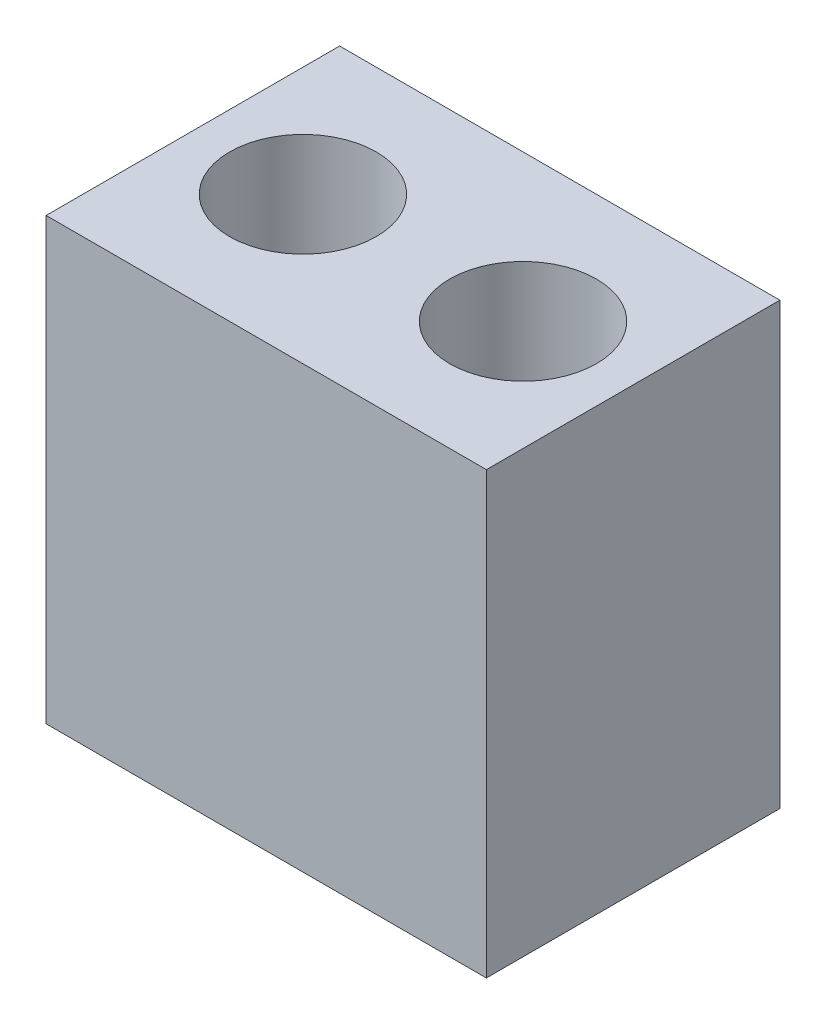
from build123d import *

# Parameters (mm, degrees)
SKETCH1_W           = 30
SKETCH1_H           = 30
BOSS_EXTRUDE1_DEPTH = 20
SKETCH2_R           = 3
SKETCH2_R_2         = 2.53
CUT_EXTRUDE1_DEPTH  = 40.05124838
SKETCH3_R           = 5
CUT_EXTRUDE2_DEPTH  = 15


with BuildPart() as part:
    # Sketch1 → Boss-Extrude1 (new body)
    with BuildSketch(Plane.XY):
        Rectangle(SKETCH1_W, SKETCH1_H)
    extrude(amount=BOSS_EXTRUDE1_DEPTH)

    # Sketch2 → Cut-Extrude1 (cut, through all)
    with BuildSketch(Plane(origin=(0, 15, 0), x_dir=(1, 0, 0), z_dir=(0, 1, 0))):
        with Locations(Location((-7.5, -10, 0), (0, 0, 270))):
            Circle(SKETCH2_R)
        with Locations(Location((7.5, -10, 0), (0, 0, 270))):
            Circle(SKETCH2_R_2)
    extrude(amount=-CUT_EXTRUDE1_DEPTH, mode=Mode.SUBTRACT)

    # Sketch3 → Cut-Extrude2 (cut)
    with BuildSketch(Plane(origin=(0, 15, 0), x_dir=(1, 0, 0), z_dir=(0, 1, 0))):
        with Locations(Location((-7.5, -10, 0), (0, 0, 270))):
            Circle(SKETCH3_R)
        with Locations(Location((7.5, -10, 0), (0, 0, 270))):
            Circle(SKETCH3_R)
    extrude(amount=-CUT_EXTRUDE2_DEPTH, mode=Mode.SUBTRACT)


solid = part.part
